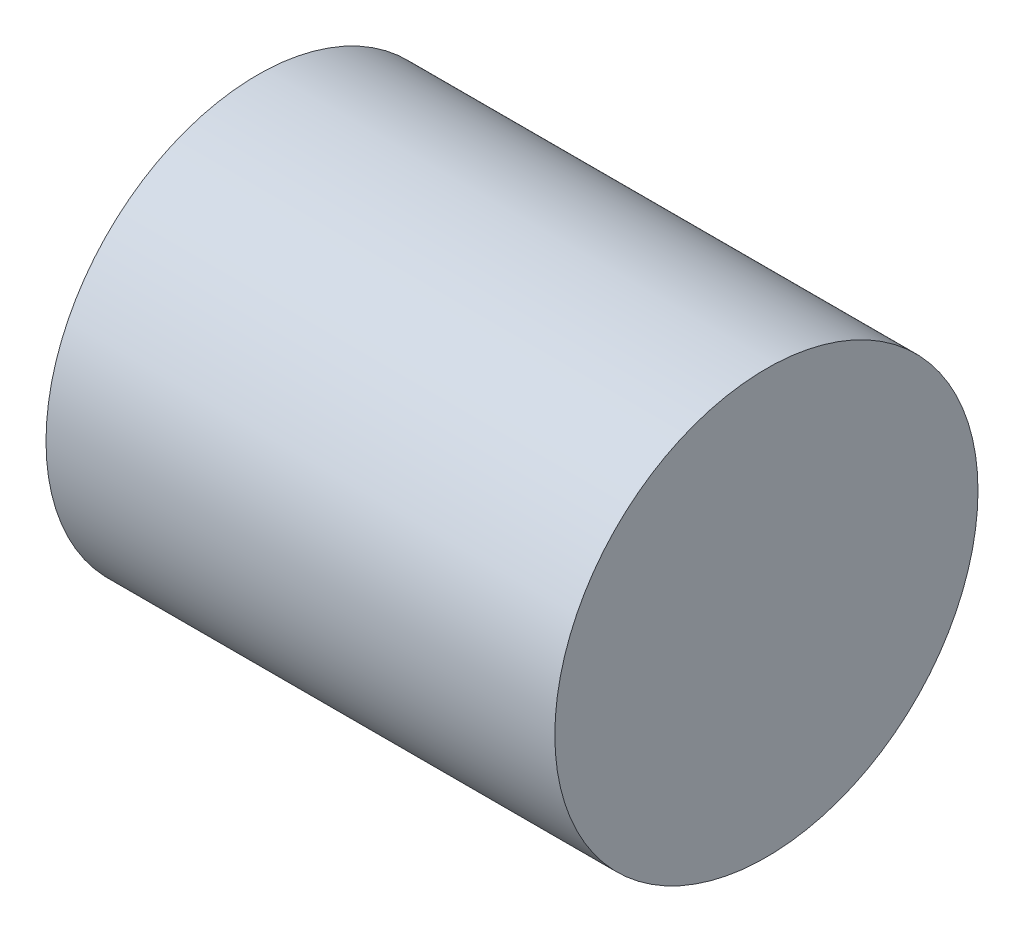
from build123d import *

# Parameters (mm, degrees)
SKETCH1_R           = 4.99
BOSS_EXTRUDE1_DEPTH = 12


with BuildPart() as part:
    # Sketch1 → Boss-Extrude1 (new body)
    with BuildSketch(Plane(origin=(0, 0, 0), x_dir=(0, 0, -1), z_dir=(1, 0, 0))):
        Circle(SKETCH1_R)
    extrude(amount=BOSS_EXTRUDE1_DEPTH)


solid = part.part
